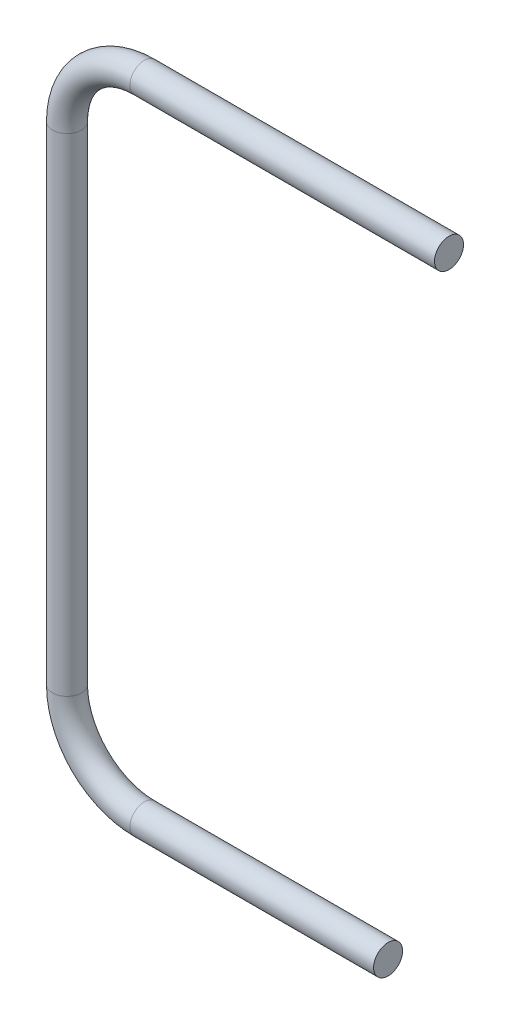
from build123d import *

# Parameters (mm, degrees)
SWEEP1_PROFILE_R = 2.38125


with BuildPart() as part:
    # Sweep1: sweep along a path in Sketch1
    with BuildLine(Plane.XY) as sweep1_path:
        Line((0, 0), (-40, 0))
        ThreePointArc((-40, 0), (-48.980256121, 3.719743879), (-52.7, 12.7))
        Line((-52.7, 12.7), (-52.7, 92.7))
        ThreePointArc((-52.7, 92.7), (-48.980256121, 101.680256121), (-40, 105.4))
        Line((-40, 105.4), (10, 105.4))
    # Sweep1 profile (on start of the path) → Sweep1 (sweep)
    with BuildSketch(Plane(origin=(0, 0, 0), x_dir=(0, -1, 0), z_dir=(-1, 0, 0))):
        Circle(SWEEP1_PROFILE_R)
    sweep(path=sweep1_path.line)


solid = part.part
